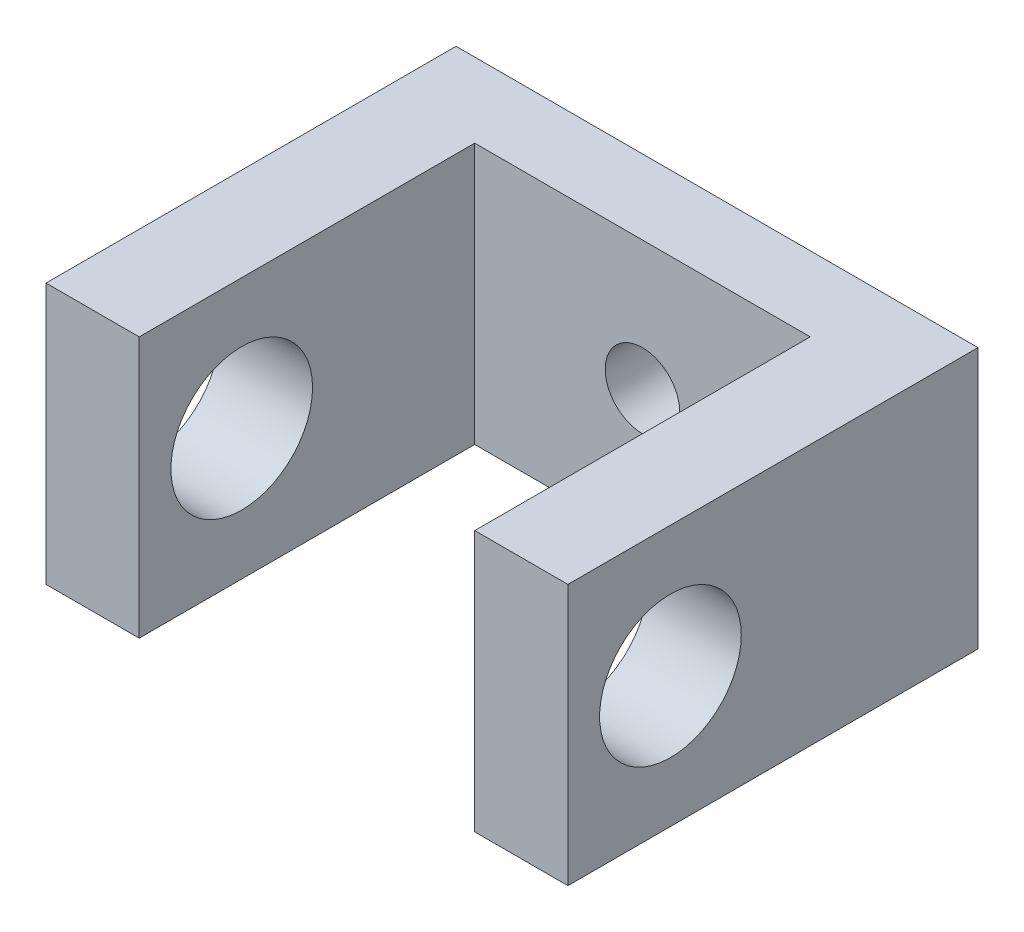
from build123d import *

# Parameters (mm, degrees)
SKETCH_1_W          = 28
SKETCH_1_H          = 14
EXTRUDE_1_DEPTH     = 22
SKETCH_2_W          = 18
SKETCH_2_H          = 18
CUT_EXTRUDE_1_DEPTH = 22
SKETCH_3_R          = 3.8
CUT_EXTRUDE_2_DEPTH = 29
SKETCH_4_R          = 2
CUT_EXTRUDE_3_DEPTH = 29


with BuildPart() as part:
    # Эскиз1 → Бобышка-Вытянуть1 (new body)
    with BuildSketch(Plane.XY):
        Rectangle(SKETCH_1_W, SKETCH_1_H)
    extrude(amount=EXTRUDE_1_DEPTH)

    # Эскиз2 → Вырез-Вытянуть1 (cut)
    with BuildSketch(Plane.XZ.offset(7)):
        with Locations((0, 13)):
            Rectangle(SKETCH_2_W, SKETCH_2_H)
    extrude(amount=-CUT_EXTRUDE_1_DEPTH, mode=Mode.SUBTRACT)

    # Эскиз3 → Вырез-Вытянуть2 (cut)
    with BuildSketch(Plane(origin=(14, 0, 0), x_dir=(0, 0, -1), z_dir=(1, 0, 0))):
        with Locations((-16.5, 0)):
            Circle(SKETCH_3_R)
    extrude(amount=-CUT_EXTRUDE_2_DEPTH, mode=Mode.SUBTRACT)

    # Эскиз4 → Вырез-Вытянуть3 (cut)
    with BuildSketch(Plane.XY.offset(4)):
        Circle(SKETCH_4_R)
    extrude(amount=-CUT_EXTRUDE_3_DEPTH, mode=Mode.SUBTRACT)


solid = part.part
